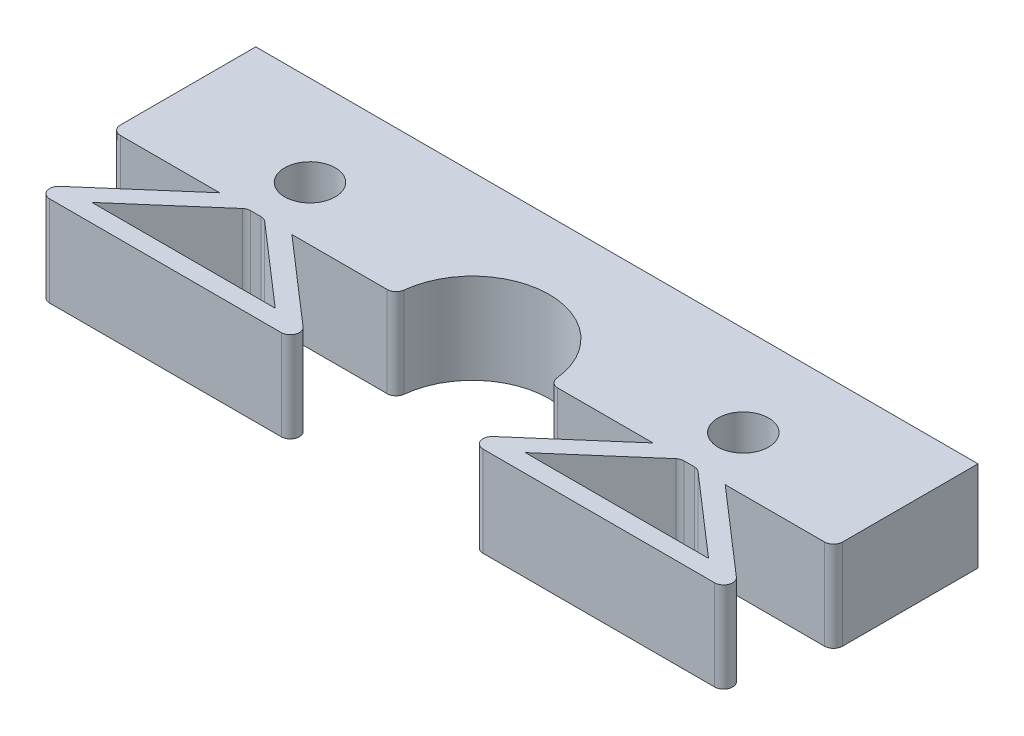
from build123d import *

# Parameters (mm, degrees)
SKETCH1_R           = 1.4
BOSS_EXTRUDE1_DEPTH = 5
CUT_EXTRUDE1_DEPTH  = 23.113344387
FILLET1_R           = 0.5


with BuildPart() as part:
    # Sketch1 → Boss-Extrude1 (new body)
    with BuildSketch(Plane(origin=(0, 0, 0), x_dir=(1, 0, 0), z_dir=(0, 1, 0))):
        Polygon((-20, 8), (20, 8), (20, 0), (14, 0), (19.75, -5), (4.25, -5), (10, 0), (-10, 0), (-4.25, -5), (-19.75, -5), (-14, 0), (-20, 0), align=None)
        with Locations(Location((12, 3, 0), (0, 0, 270))):
            Circle(SKETCH1_R, mode=Mode.SUBTRACT)
        with Locations(Location((-12, 3, 0), (0, 0, 90))):
            Circle(SKETCH1_R, mode=Mode.SUBTRACT)
        Polygon((12.476024935, 0), (11.523975065, 0), (6.923975065, -4), (17.076024935, -4), align=None, mode=Mode.SUBTRACT)
        Polygon((-12.476024935, 0), (-11.523975065, 0), (-6.923975065, -4), (-17.076024935, -4), align=None, mode=Mode.SUBTRACT)
    extrude(amount=BOSS_EXTRUDE1_DEPTH)

    # Sketch2 → Cut-Extrude1 (cut, through all)
    with BuildSketch(Plane(origin=(0, 5, 0), x_dir=(1, 0, 0), z_dir=(0, 1, 0))):
        with BuildLine():
            Line((-4.25, 0), (4.25, 0))
            ThreePointArc((4.25, 0), (0, 4.25), (-4.25, 0))
        make_face()
    extrude(amount=-CUT_EXTRUDE1_DEPTH, mode=Mode.SUBTRACT)

    # Fillet1
    fillet1_edges = [part.edges().sort_by_distance(p)[0] for p in [
        (20, 2.5, 0),
        (19.75, 2.5, 5),
        (4.25, 2.5, 5),
        (-4.25, 2.5, 5),
        (-19.75, 2.5, 5),
        (-20, 2.5, 0),
        (11.523975065, 2.5, 0),
        (12.476024935, 2.5, 0),
        (-12.476024935, 2.5, 0),
        (-11.523975065, 2.5, 0),
        (-4.25, 2.5, 0),
        (4.25, 2.5, 0),
    ]]
    fillet(fillet1_edges, radius=FILLET1_R)


solid = part.part
